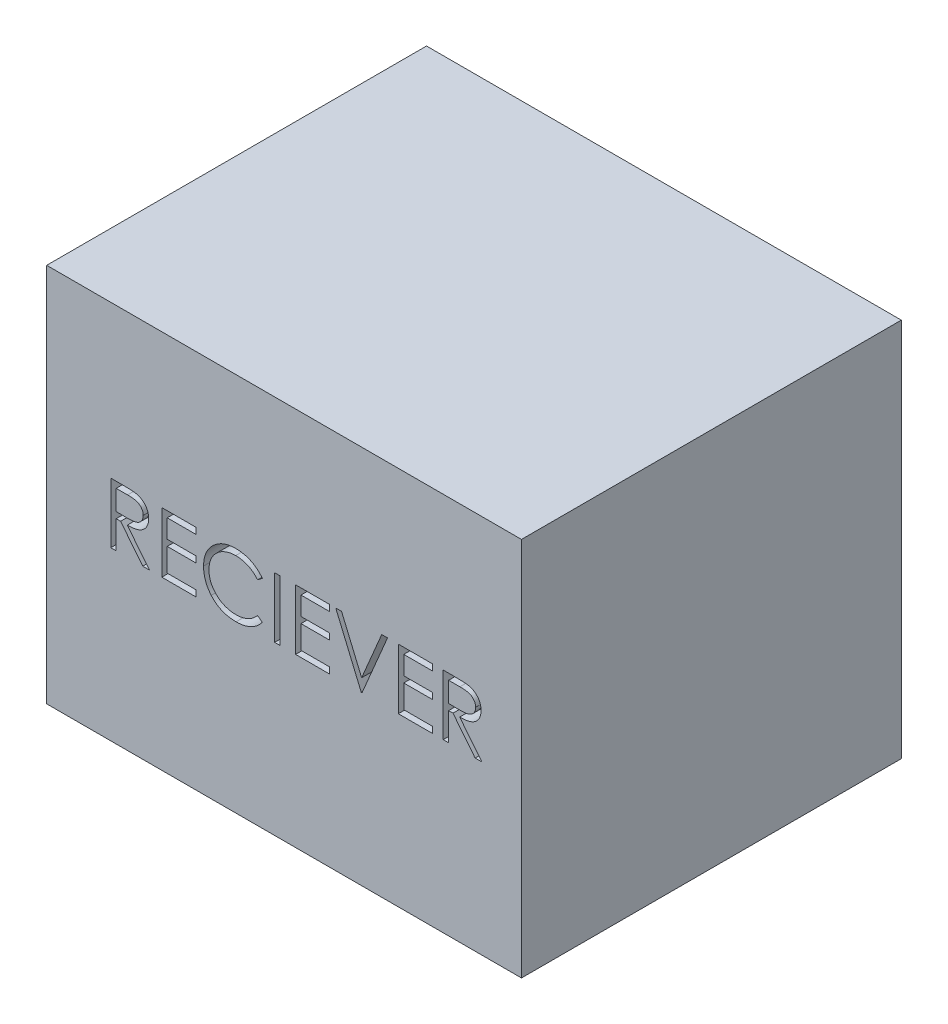
from build123d import *

# Parameters (mm, degrees)
SKETCH1_W           = 40
SKETCH1_H           = 40
BOSS_EXTRUDE1_DEPTH = 25
SKETCH2_W           = 0.569871795
SKETCH2_H           = 6.35
CUT_EXTRUDE1_DEPTH  = 10


with BuildPart() as part:
    # Sketch1 → Boss-Extrude1 (new, symmetric)
    with BuildSketch(Plane(origin=(0, 0, 0), x_dir=(0, 0, -1), z_dir=(1, 0, 0))):
        Rectangle(SKETCH1_W, SKETCH1_H)
    extrude(amount=BOSS_EXTRUDE1_DEPTH, both=True)

    # Sketch2 → Cut-Extrude1 (cut)
    # profile 1 of 8: a face of its own
    with BuildSketch(Plane.XY.offset(20)):
        with BuildLine():
            Line((-18.250441683, 3.966931969), (-16.979678461, 3.966931969))
            add(Edge.make_bspline(
                [(-16.979678461, 3.966931969), (-16.8948767, 3.966649692), (-16.732047923, 3.966107688), (-16.498779276, 3.963085518), (-16.286821543, 3.954423473), (-16.096285548, 3.946969328), (-15.927174789, 3.933376806), (-15.778970704, 3.920385346), (-15.652355881, 3.903378848), (-15.575709837, 3.887584723), (-15.541006586, 3.880433572)],
                knots=[0, 0, 0, 0, 1.410062039, 2.707475311, 3.878576406, 4.937260626, 5.877586885, 6.699081471, 7.410979367, 8, 8, 8, 8], degree=3))
            add(Edge.make_bspline(
                [(-15.541006586, 3.880433572), (-15.494548854, 3.868955012), (-15.402624459, 3.846242761), (-15.270272196, 3.798237485), (-15.144153351, 3.742684737), (-15.024791813, 3.677436273), (-14.912785449, 3.602007744), (-14.806979371, 3.517701294), (-14.706893459, 3.42497822), (-14.616575358, 3.321500722), (-14.531414507, 3.212940197), (-14.459589428, 3.095549096), (-14.397674243, 2.972791753), (-14.348379162, 2.843419724), (-14.308686268, 2.708687652), (-14.280698662, 2.567375121), (-14.263914364, 2.420125923), (-14.262205569, 2.31969086), (-14.261339118, 2.268764902)],
                knots=[0, 0, 0, 0, 1.027469482, 2.033020251, 3.019912614, 3.986113645, 4.951240523, 5.91722682, 6.890402269, 7.87763091, 8.8651537, 9.85103654, 10.82876324, 11.815024772, 12.821070561, 13.842952187, 14.906261191, 16, 16, 16, 16], degree=3))
            add(Edge.make_bspline(
                [(-14.261339118, 2.268764902), (-14.264004301, 2.184155498), (-14.269204762, 2.019060636), (-14.317691736, 1.779464465), (-14.39711485, 1.555963852), (-14.506558531, 1.348840209), (-14.645931009, 1.162130895), (-14.813434558, 0.998136783), (-15.009162625, 0.86090437), (-15.191370098, 0.765739996), (-15.352323003, 0.704792862), (-15.484826299, 0.661909754), (-15.629364958, 0.628777331), (-15.784554123, 0.599095378), (-15.951039612, 0.576685875), (-16.128422398, 0.560272768), (-16.316828987, 0.550014708), (-16.446258441, 0.548487071), (-16.512841522, 0.5477012)],
                knots=[0, 0, 0, 0, 1.260483769, 2.459530307, 3.627416485, 4.787058657, 5.939039949, 7.08810263, 8.267026773, 9.491475466, 10.141966685, 10.831826277, 11.566392101, 12.351337768, 13.187381173, 14.07005841, 15.007169909, 16, 16, 16, 16], degree=3))
            Line((-16.512841522, 0.5477012), (-14.179928862, -2.383068031))
            Line((-14.179928862, -2.383068031), (-14.884636394, -2.383068031))
            Line((-14.884636394, -2.383068031), (-17.217549054, 0.5477012))
            Line((-17.217549054, 0.5477012), (-17.680569888, 0.5477012))
            Line((-17.680569888, 0.5477012), (-17.680569888, -2.383068031))
            Line((-17.680569888, -2.383068031), (-18.250441683, -2.383068031))
            Line((-18.250441683, -2.383068031), (-18.250441683, 3.966931969))
        make_face()
        with BuildLine():
            Line((-17.680569888, 3.315649918), (-17.680569888, 1.198983251))
            Line((-17.680569888, 1.198983251), (-16.517929663, 1.190079004))
            add(Edge.make_bspline(
                [(-16.517929663, 1.190079004), (-16.463646164, 1.190054989), (-16.358429282, 1.190008441), (-16.206209504, 1.197254292), (-16.064477302, 1.20549717), (-15.933774794, 1.218105268), (-15.814043593, 1.234354141), (-15.705343544, 1.254679555), (-15.607497207, 1.278359726), (-15.493381287, 1.315011247), (-15.365952151, 1.373079309), (-15.227465074, 1.457562428), (-15.109532261, 1.563823544), (-15.009895568, 1.685332529), (-14.929832171, 1.818929723), (-14.873386016, 1.963013707), (-14.837567585, 2.113947035), (-14.833342938, 2.217684459), (-14.831210913, 2.270036937)],
                knots=[0, 0, 0, 0, 1.146690395, 2.22261258, 3.21895312, 4.145990853, 4.996080663, 5.770904154, 6.481378293, 7.121626537, 8.300444488, 9.431385265, 10.535395872, 11.636531494, 12.74115979, 13.810798291, 14.895190096, 16, 16, 16, 16], degree=3))
            add(Edge.make_bspline(
                [(-14.831210913, 2.270036937), (-14.833391904, 2.321102864), (-14.837713833, 2.422296897), (-14.872999456, 2.570444048), (-14.932670191, 2.710265515), (-15.013083394, 2.841192509), (-15.111053289, 2.96003863), (-15.225929892, 3.061724179), (-15.354572175, 3.145633922), (-15.474807063, 3.199254012), (-15.582274849, 3.232128603), (-15.675582946, 3.255262858), (-15.78101377, 3.273849251), (-15.899079245, 3.288741019), (-16.029275347, 3.301540703), (-16.172260385, 3.310161788), (-16.327085686, 3.315266941), (-16.434395119, 3.315519288), (-16.489944888, 3.315649918)],
                knots=[0, 0, 0, 0, 1.101028733, 2.181837193, 3.264309656, 4.369019818, 5.486613113, 6.575447106, 7.666700264, 8.788928104, 9.402425223, 10.0903467, 10.862060571, 11.710948788, 12.657782767, 13.684531032, 14.801375019, 16, 16, 16, 16], degree=3))
            Line((-16.489944888, 3.315649918), (-17.680569888, 3.315649918))
        make_face(mode=Mode.SUBTRACT)
    # profile 2 of 8: a face of its own
    with BuildSketch(Plane.XY.offset(20)):
        Polygon((-12.87736476, 3.966931969), (-9.295313477, 3.966931969), (-9.295313477, 3.315649918), (-12.307492965, 3.315649918), (-12.307492965, 1.361803764), (-9.295313477, 1.361803764), (-9.295313477, 0.710521713), (-12.307492965, 0.710521713), (-12.307492965, -1.73178598), (-9.295313477, -1.73178598), (-9.295313477, -2.383068031), (-12.87736476, -2.383068031), align=None)
    # profile 3 of 8: a face of its own
    with BuildSketch(Plane.XY.offset(20)):
        with BuildLine():
            Line((-2.294031426, 2.801747674), (-2.792669247, 2.420137097))
            add(Edge.make_bspline(
                [(-2.792669247, 2.420137097), (-2.82823993, 2.462529643), (-2.898901726, 2.54674319), (-3.012583422, 2.664997506), (-3.13105926, 2.775787338), (-3.254283951, 2.879640462), (-3.384475497, 2.972925166), (-3.518480089, 3.060502738), (-3.658539399, 3.139002777), (-3.852217546, 3.234185623), (-4.105578643, 3.33351079), (-4.424520708, 3.416792367), (-4.757462272, 3.469807928), (-4.984606489, 3.475549855), (-5.100141202, 3.478470431)],
                knots=[0, 0, 0, 0, 0.757959112, 1.505699292, 2.245454638, 2.979532153, 3.711538275, 4.438200793, 5.171680507, 5.909471876, 7.393775596, 8.890124382, 10.418191784, 12, 12, 12, 12], degree=3))
            add(Edge.make_bspline(
                [(-5.100141202, 3.478470431), (-5.163792331, 3.477737527), (-5.290503846, 3.476278523), (-5.478551791, 3.457030538), (-5.663088326, 3.429977343), (-5.843993415, 3.389835685), (-6.021036782, 3.339085362), (-6.195375855, 3.278442111), (-6.364486514, 3.203412616), (-6.530708175, 3.120484773), (-6.689964744, 3.026817837), (-6.84065033, 2.924649327), (-6.982215358, 2.815122538), (-7.114771811, 2.697826959), (-7.238455203, 2.573290831), (-7.352369324, 2.440186954), (-7.456119997, 2.298940868), (-7.551763743, 2.151415114), (-7.63742113, 1.998039407), (-7.709139626, 1.838246064), (-7.772648919, 1.674771478), (-7.822903259, 1.505768657), (-7.862680597, 1.332426782), (-7.8901265, 1.154280638), (-7.909155584, 0.971702391), (-7.910607333, 0.847951209), (-7.911339118, 0.785571793)],
                knots=[0, 0, 0, 0, 1.054917814, 2.100044995, 3.131103042, 4.146048494, 5.169673617, 6.183595914, 7.203665975, 8.234915748, 9.262203917, 10.264457458, 11.251630812, 12.227803204, 13.197192746, 14.159520551, 15.12972552, 16.100847026, 17.073214652, 18.039054194, 19.002613845, 19.979014051, 20.95965708, 21.949030935, 22.966165397, 24, 24, 24, 24], degree=3))
            add(Edge.make_bspline(
                [(-7.911339118, 0.785571793), (-7.909049818, 0.691716398), (-7.904555081, 0.50744378), (-7.864553103, 0.237531387), (-7.803765295, -0.021041836), (-7.712659891, -0.26665955), (-7.600321042, -0.502350428), (-7.458370218, -0.724126633), (-7.293965929, -0.935339543), (-7.10478234, -1.130997463), (-6.897217502, -1.309729507), (-6.67451772, -1.467119848), (-6.437237655, -1.598319706), (-6.187997197, -1.707496066), (-5.92487839, -1.791418987), (-5.648354392, -1.850499611), (-5.359026629, -1.889038995), (-5.161325003, -1.892728687), (-5.060708109, -1.894606492)],
                knots=[0, 0, 0, 0, 1.029171465, 2.020641659, 2.987623507, 3.938342917, 4.889210282, 5.84687017, 6.821220943, 7.821438502, 8.827599549, 9.822697543, 10.807740252, 11.797342354, 12.80366471, 13.83203677, 14.896651826, 16, 16, 16, 16], degree=3))
            add(Edge.make_bspline(
                [(-5.060708109, -1.894606492), (-4.949850373, -1.891542563), (-4.73165583, -1.885512018), (-4.411673839, -1.834423095), (-4.105357522, -1.751586587), (-3.8126904, -1.635657499), (-3.534497542, -1.484953334), (-3.270343601, -1.302258613), (-3.020005609, -1.085835495), (-2.869471997, -0.920584677), (-2.792669247, -0.836273159)],
                knots=[0, 0, 0, 0, 1.028121516, 2.023589091, 2.998037872, 3.967518031, 4.937445131, 5.927275754, 6.942489185, 8, 8, 8, 8], degree=3))
            Line((-2.792669247, -0.836273159), (-2.294031426, -1.21406763))
            add(Edge.make_bspline(
                [(-2.294031426, -1.21406763), (-2.334159997, -1.265844536), (-2.414224925, -1.369150339), (-2.543870184, -1.514786155), (-2.68044471, -1.651772048), (-2.824962926, -1.779003589), (-2.975762348, -1.899026691), (-3.135550686, -2.008431442), (-3.30222736, -2.108744904), (-3.475227628, -2.200596609), (-3.654367683, -2.282089329), (-3.839432872, -2.351855451), (-4.029625488, -2.411953465), (-4.224954224, -2.461396264), (-4.42582424, -2.499988088), (-4.631510672, -2.525786641), (-4.842457446, -2.543461257), (-4.984772595, -2.54507219), (-5.056892003, -2.545888544)],
                knots=[0, 0, 0, 0, 0.986787822, 1.968848986, 2.935600012, 3.899624008, 4.868462664, 5.837806735, 6.815139263, 7.798259679, 8.787526145, 9.778297419, 10.776456485, 11.791383307, 12.812564526, 13.85620153, 14.913611965, 16, 16, 16, 16], degree=3))
            add(Edge.make_bspline(
                [(-5.056892003, -2.545888544), (-5.12518837, -2.545413214), (-5.26023598, -2.544473309), (-5.459623715, -2.52924752), (-5.653733383, -2.508474426), (-5.842010204, -2.477195902), (-6.025481616, -2.440285457), (-6.202484391, -2.390807605), (-6.374760272, -2.335382689), (-6.541617119, -2.270240784), (-6.70319686, -2.196732853), (-6.858978346, -2.113653882), (-7.008889931, -2.021702499), (-7.15440548, -1.922905552), (-7.293375382, -1.81408959), (-7.427003921, -1.696765838), (-7.556040413, -1.571329733), (-7.635873856, -1.480878785), (-7.676012596, -1.435401765)],
                knots=[0, 0, 0, 0, 1.114604814, 2.203992996, 3.262667896, 4.300477797, 5.318619304, 6.316056647, 7.298880507, 8.271930387, 9.238335007, 10.195173496, 11.151986948, 12.108099108, 13.064862484, 14.031167946, 15.010108607, 16, 16, 16, 16], degree=3))
            add(Edge.make_bspline(
                [(-7.676012596, -1.435401765), (-7.740302978, -1.356405608), (-7.868107572, -1.199367005), (-8.031621312, -0.944848153), (-8.171589019, -0.679112974), (-8.284756761, -0.400765389), (-8.373226291, -0.110429986), (-8.434515031, 0.19203959), (-8.474341513, 0.506360856), (-8.478895894, 0.720150459), (-8.481210913, 0.828820992)],
                knots=[0, 0, 0, 0, 0.994628077, 1.977248131, 2.950237994, 3.925870899, 4.908910175, 5.911660606, 6.938484602, 8, 8, 8, 8], degree=3))
            add(Edge.make_bspline(
                [(-8.481210913, 0.828820992), (-8.478389348, 0.943040172), (-8.472838094, 1.167759278), (-8.425674294, 1.497549164), (-8.349803049, 1.813509559), (-8.242040123, 2.115050639), (-8.1054147, 2.403758433), (-7.936637843, 2.677427476), (-7.737670314, 2.937807955), (-7.510072584, 3.180949004), (-7.260486133, 3.403270401), (-6.993207713, 3.598861656), (-6.708760466, 3.761634864), (-6.410278078, 3.89769933), (-6.095525485, 4.002282856), (-5.765174229, 4.075495066), (-5.419845055, 4.121064692), (-5.184237512, 4.126825426), (-5.064524215, 4.129752482)],
                knots=[0, 0, 0, 0, 1.032925535, 2.032216505, 3.007276963, 3.968222605, 4.92396291, 5.891752235, 6.871517503, 7.883894988, 8.900124299, 9.891468569, 10.874487609, 11.85992873, 12.854644235, 13.869047385, 14.917252991, 16, 16, 16, 16], degree=3))
            add(Edge.make_bspline(
                [(-5.064524215, 4.129752482), (-4.991563673, 4.128877746), (-4.847145628, 4.127146293), (-4.633508673, 4.110262292), (-4.425514736, 4.082116178), (-4.223020526, 4.043805594), (-4.025040923, 3.996258025), (-3.833089057, 3.93431777), (-3.646038582, 3.863494349), (-3.465069192, 3.781926846), (-3.291049165, 3.690365758), (-3.124032701, 3.589825984), (-2.965346458, 3.480432165), (-2.813873833, 3.36311469), (-2.672148707, 3.23539159), (-2.536147167, 3.100775951), (-2.410487783, 2.955390299), (-2.332921272, 2.853055633), (-2.294031426, 2.801747674)],
                knots=[0, 0, 0, 0, 1.096760587, 2.17092713, 3.219439832, 4.250915756, 5.268269357, 6.278326846, 7.281116186, 8.274029601, 9.260640565, 10.235837813, 11.203064059, 12.156899882, 13.114053108, 14.069676657, 15.032185724, 16, 16, 16, 16], degree=3))
        make_face()
    # profile 4 of 8: a face of its own
    with BuildSketch(Plane.XY.offset(20)):
        with Locations((-0.706531427, 0.791931969)):
            Rectangle(SKETCH2_W, SKETCH2_H)
    # profile 5 of 8: a face of its own
    with BuildSketch(Plane.XY.offset(20)):
        Polygon((1.206609599, 3.966931969), (4.788660882, 3.966931969), (4.788660882, 3.315649918), (1.776481394, 3.315649918), (1.776481394, 1.361803764), (4.788660882, 1.361803764), (4.788660882, 0.710521713), (1.776481394, 0.710521713), (1.776481394, -1.73178598), (4.788660882, -1.73178598), (4.788660882, -2.383068031), (1.206609599, -2.383068031), align=None)
    # profile 6 of 8: a face of its own
    with BuildSketch(Plane.XY.offset(20)):
        Polygon((5.439942933, 3.966931969), (6.050519856, 3.966931969), (8.165914487, -1.033438624), (10.282581154, 3.966931969), (10.894430112, 3.966931969), (8.207891651, -2.383068031), (8.126481394, -2.383068031), align=None)
    # profile 7 of 8: a face of its own
    with BuildSketch(Plane.XY.offset(20)):
        Polygon((12.034173702, 3.966931969), (15.616224984, 3.966931969), (15.616224984, 3.315649918), (12.604045497, 3.315649918), (12.604045497, 1.361803764), (15.616224984, 1.361803764), (15.616224984, 0.710521713), (12.604045497, 0.710521713), (12.604045497, -1.73178598), (15.616224984, -1.73178598), (15.616224984, -2.383068031), (12.034173702, -2.383068031), align=None)
    # profile 8 of 8: a face of its own
    with BuildSketch(Plane.XY.offset(20)):
        with BuildLine():
            Line((16.755968574, 3.966931969), (18.026731795, 3.966931969))
            add(Edge.make_bspline(
                [(18.026731795, 3.966931969), (18.111533557, 3.966649692), (18.274362333, 3.966107688), (18.507630981, 3.963085518), (18.719588714, 3.954423473), (18.910124708, 3.946969328), (19.079235468, 3.933376806), (19.227439552, 3.920385346), (19.354054375, 3.903378848), (19.430700419, 3.887584723), (19.46540367, 3.880433572)],
                knots=[0, 0, 0, 0, 1.410062039, 2.707475311, 3.878576406, 4.937260626, 5.877586885, 6.699081471, 7.410979367, 8, 8, 8, 8], degree=3))
            add(Edge.make_bspline(
                [(19.46540367, 3.880433572), (19.511861402, 3.868955012), (19.603785798, 3.846242761), (19.73613806, 3.798237485), (19.862256905, 3.742684737), (19.981618443, 3.677436273), (20.093624807, 3.602007744), (20.199430886, 3.517701294), (20.299516798, 3.42497822), (20.389834898, 3.321500722), (20.474995749, 3.212940197), (20.546820829, 3.095549096), (20.608736013, 2.972791753), (20.658031094, 2.843419724), (20.697723989, 2.708687652), (20.725711595, 2.567375121), (20.742495892, 2.420125923), (20.744204687, 2.31969086), (20.745071138, 2.268764902)],
                knots=[0, 0, 0, 0, 1.027469482, 2.033020251, 3.019912614, 3.986113645, 4.951240523, 5.91722682, 6.890402269, 7.87763091, 8.8651537, 9.85103654, 10.82876324, 11.815024772, 12.821070561, 13.842952187, 14.906261191, 16, 16, 16, 16], degree=3))
            add(Edge.make_bspline(
                [(20.745071138, 2.268764902), (20.742405956, 2.184155498), (20.737205495, 2.019060636), (20.688718521, 1.779464465), (20.609295407, 1.555963852), (20.499851725, 1.348840209), (20.360479248, 1.162130895), (20.192975698, 0.998136783), (19.997247632, 0.86090437), (19.815040158, 0.765739996), (19.654087253, 0.704792862), (19.521583957, 0.661909754), (19.377045298, 0.628777331), (19.221856134, 0.599095378), (19.055370644, 0.576685875), (18.877987859, 0.560272768), (18.689581269, 0.550014708), (18.560151815, 0.548487071), (18.493568734, 0.5477012)],
                knots=[0, 0, 0, 0, 1.260483769, 2.459530307, 3.627416485, 4.787058657, 5.939039949, 7.08810263, 8.267026773, 9.491475466, 10.141966685, 10.831826277, 11.566392101, 12.351337768, 13.187381173, 14.07005841, 15.007169909, 16, 16, 16, 16], degree=3))
            Line((18.493568734, 0.5477012), (20.826481394, -2.383068031))
            Line((20.826481394, -2.383068031), (20.121773862, -2.383068031))
            Line((20.121773862, -2.383068031), (17.788861202, 0.5477012))
            Line((17.788861202, 0.5477012), (17.325840369, 0.5477012))
            Line((17.325840369, 0.5477012), (17.325840369, -2.383068031))
            Line((17.325840369, -2.383068031), (16.755968574, -2.383068031))
            Line((16.755968574, -2.383068031), (16.755968574, 3.966931969))
        make_face()
        with BuildLine():
            Line((17.325840369, 3.315649918), (17.325840369, 1.198983251))
            Line((17.325840369, 1.198983251), (18.488480593, 1.190079004))
            add(Edge.make_bspline(
                [(18.488480593, 1.190079004), (18.542764092, 1.190054989), (18.647980974, 1.190008441), (18.800200752, 1.197254292), (18.941932955, 1.20549717), (19.072635462, 1.218105268), (19.192366663, 1.234354141), (19.301066713, 1.254679555), (19.39891305, 1.278359726), (19.51302897, 1.315011247), (19.640458105, 1.373079309), (19.778945182, 1.457562428), (19.896877995, 1.563823544), (19.996514688, 1.685332529), (20.076578085, 1.818929723), (20.133024241, 1.963013707), (20.168842672, 2.113947035), (20.173067319, 2.217684459), (20.175199343, 2.270036937)],
                knots=[0, 0, 0, 0, 1.146690395, 2.22261258, 3.21895312, 4.145990853, 4.996080663, 5.770904154, 6.481378293, 7.121626537, 8.300444488, 9.431385265, 10.535395872, 11.636531494, 12.74115979, 13.810798291, 14.895190096, 16, 16, 16, 16], degree=3))
            add(Edge.make_bspline(
                [(20.175199343, 2.270036937), (20.173018352, 2.321102864), (20.168696423, 2.422296897), (20.1334108, 2.570444048), (20.073740066, 2.710265515), (19.993326863, 2.841192509), (19.895356967, 2.96003863), (19.780480364, 3.061724179), (19.651838082, 3.145633922), (19.531603193, 3.199254012), (19.424135408, 3.232128603), (19.33082731, 3.255262858), (19.225396486, 3.273849251), (19.107331011, 3.288741019), (18.97713491, 3.301540703), (18.834149871, 3.310161788), (18.67932457, 3.315266941), (18.572015138, 3.315519288), (18.516465369, 3.315649918)],
                knots=[0, 0, 0, 0, 1.101028733, 2.181837193, 3.264309656, 4.369019818, 5.486613113, 6.575447106, 7.666700264, 8.788928104, 9.402425223, 10.0903467, 10.862060571, 11.710948788, 12.657782767, 13.684531032, 14.801375019, 16, 16, 16, 16], degree=3))
            Line((18.516465369, 3.315649918), (17.325840369, 3.315649918))
        make_face(mode=Mode.SUBTRACT)
    extrude(amount=-CUT_EXTRUDE1_DEPTH, mode=Mode.SUBTRACT)


solid = part.part
